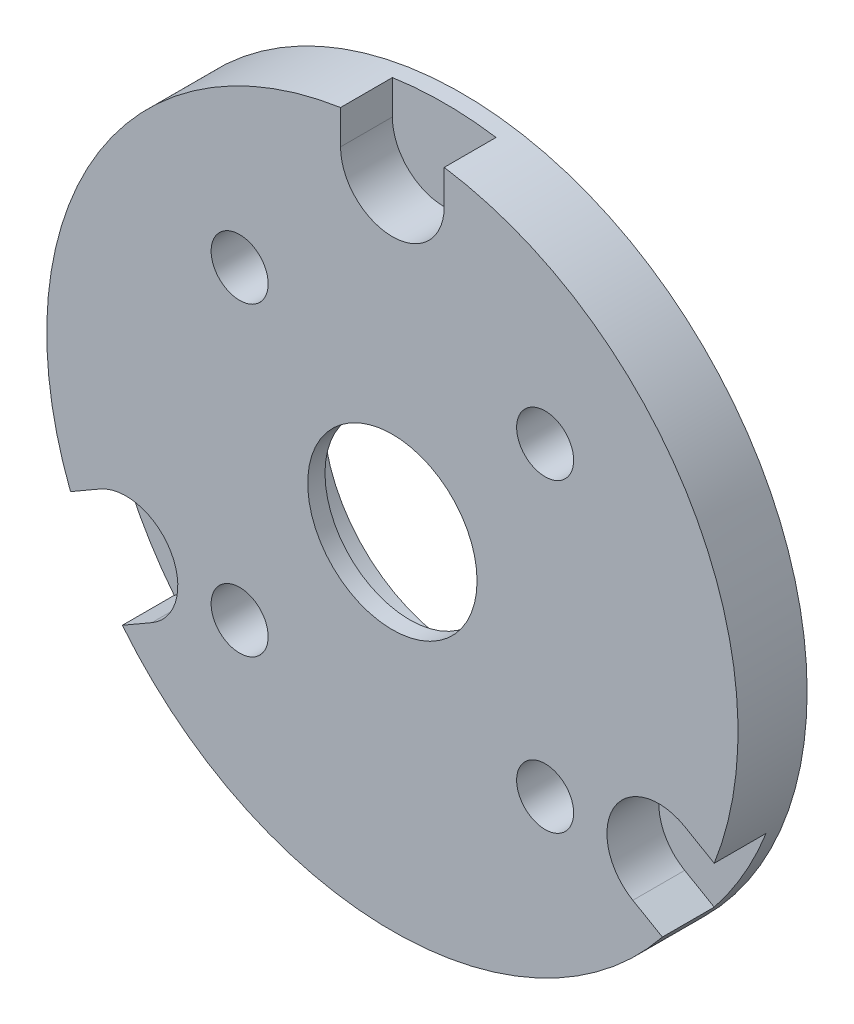
from build123d import *

# Parameters (mm, degrees)
SKETCH1_R             = 20
BOSS_EXTRUDE1_DEPTH   = 4
CUT_EXTRUDE1_DEPTH    = 3
M4X0_7_TAPPED_HOLE1_D = 3.3
SKETCH5_R             = 4.9
CUT_EXTRUDE2_DEPTH    = 29.565713714
SKETCH6_R             = 8
CUT_EXTRUDE3_DEPTH    = 3


with BuildPart() as part:
    # Sketch1 → Boss-Extrude1 (new body)
    with BuildSketch(Plane.XY):
        Circle(SKETCH1_R)
    extrude(amount=BOSS_EXTRUDE1_DEPTH)

    # Sketch2 → Cut-Extrude1 (cut)
    with BuildSketch(Plane.XY.offset(4)):
        with BuildLine():
            Line((-3, 17.8), (-3, 25))
            Line((-3, 25), (3, 25))
            Line((3, 25), (3, 17.8))
            ThreePointArc((3, 17.8), (0, 14.8), (-3, 17.8))
        make_face()
        with BuildLine():
            Line((16.915252187, -6.301923789), (23.150635095, -9.901923789))
            Line((23.150635095, -9.901923789), (20.150635095, -15.098076211))
            Line((20.150635095, -15.098076211), (13.915252187, -11.498076211))
            ThreePointArc((13.915252187, -11.498076211), (12.817175976, -7.4), (16.915252187, -6.301923789))
        make_face()
        with BuildLine():
            Line((-13.915252187, -11.498076211), (-20.150635095, -15.098076211))
            Line((-20.150635095, -15.098076211), (-23.150635095, -9.901923789))
            Line((-23.150635095, -9.901923789), (-16.915252187, -6.301923789))
            ThreePointArc((-16.915252187, -6.301923789), (-12.817175976, -7.4), (-13.915252187, -11.498076211))
        make_face()
    extrude(amount=-CUT_EXTRUDE1_DEPTH, mode=Mode.SUBTRACT)

    # M4x0.7 Tapped Hole1 (through all)
    with Locations(Plane.XY.offset(4)):
        with Locations((-8.838834765, 8.838834765), (8.838834765, 8.838834765), (8.838834765, -8.838834765), (-8.838834765, -8.838834765)):
            Hole(M4X0_7_TAPPED_HOLE1_D / 2)

    # Sketch5 → Cut-Extrude2 (cut, through all)
    with BuildSketch(Plane.XY.offset(4)):
        Circle(SKETCH5_R)
    extrude(amount=-CUT_EXTRUDE2_DEPTH, mode=Mode.SUBTRACT)

    # Sketch6 → Cut-Extrude3 (cut)
    with BuildSketch(Plane(origin=(0, 0, 0), x_dir=(-1, 0, 0), z_dir=(0, 0, -1))):
        Circle(SKETCH6_R)
    extrude(amount=-CUT_EXTRUDE3_DEPTH, mode=Mode.SUBTRACT)


solid = part.part
